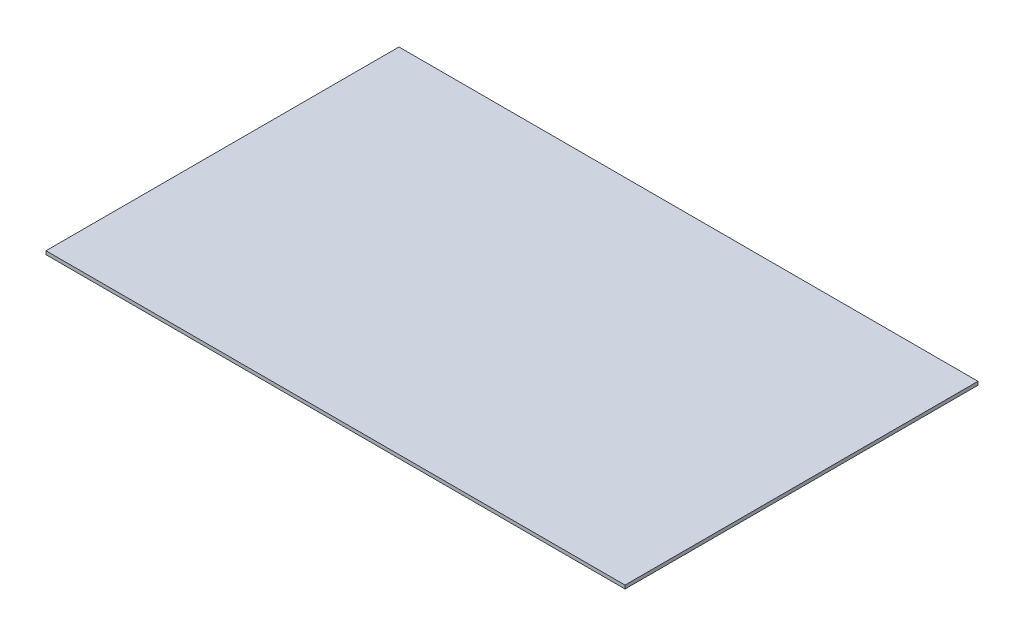
from build123d import *

# Parameters (mm, degrees)
SKETCH1_W           = 266.7
SKETCH1_H           = 162.56
BOSS_EXTRUDE1_DEPTH = 1.5875


with BuildPart() as part:
    # Sketch1 → Boss-Extrude1 (new body)
    with BuildSketch(Plane(origin=(0, 0, 0), x_dir=(1, 0, 0), z_dir=(0, 1, 0))):
        Rectangle(SKETCH1_W, SKETCH1_H)
    extrude(amount=BOSS_EXTRUDE1_DEPTH)


solid = part.part
